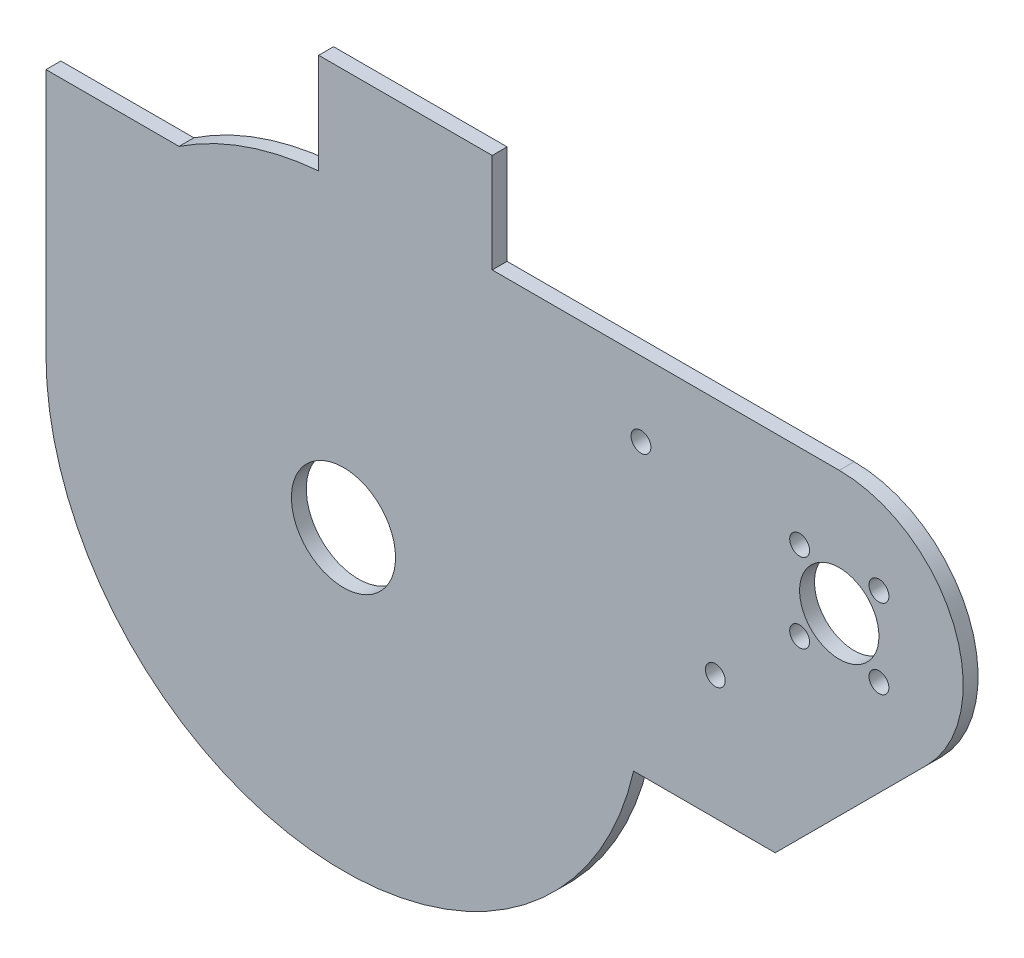
from build123d import *

# Parameters (mm, degrees)
SKETCH1_R           = 10.5
SKETCH1_R_2         = 8
BOSS_EXTRUDE1_DEPTH = 3
CUT_EXTRUDE1_REACH  = 140.687
SKETCH2_R           = 2
BOSS_EXTRUDE2_DEPTH = 3
SKETCH4_W           = 2
SKETCH4_H           = 6.5
SKETCH4_W_2         = 6.5
SKETCH4_H_2         = 2
BOSS_EXTRUDE3_DEPTH = 1
SKETCH5_R           = 2
CUT_EXTRUDE2_DEPTH  = 10


with BuildPart() as part:
    # Sketch1 → Boss-Extrude1 (new body)
    # profile 1 of 2: a face of its own
    with BuildSketch(Plane.XY):
        with BuildLine():
            ThreePointArc((-60, 0), (-52.867640737, 28.372743309), (-33.166247904, 50))
            Line((-33.166247904, 50), (-60, 50))
            Line((-60, 50), (-60, 0))
        make_face()
    # profile 2 of 2: a face of its own
    with BuildSketch(Plane.XY):
        with BuildLine():
            ThreePointArc((0, 60), (-17.320508076, 57.445626465), (-33.166247904, 50))
            ThreePointArc((-33.166247904, 50), (-52.867640737, 28.372743309), (-60, 0))
            ThreePointArc((-60, 0), (-6.678621673, -59.627141576), (58.513200418, -13.274237334))
            Line((58.513200418, -13.274237334), (87.081101726, -13.274237334))
            Line((87.081101726, -13.274237334), (117.67766953, 17.32233047))
            ThreePointArc((117.67766953, 17.32233047), (123.096988313, 44.567085809), (100, 60))
            Line((100, 60), (0, 60))
        make_face()
        Circle(SKETCH1_R, mode=Mode.SUBTRACT)
        with Locations((100, 35)):
            Circle(SKETCH1_R_2, mode=Mode.SUBTRACT)
    extrude(amount=BOSS_EXTRUDE1_DEPTH)

    # Sketch2 → Cut-Extrude1 (cut, up to next)
    with BuildSketch(Plane.XY.offset(3), mode=Mode.PRIVATE) as cut_extrude1_sk1:
        with Locations((60, 45)):
            Circle(SKETCH2_R)
    cut_extrude1_tool1 = extrude(cut_extrude1_sk1.sketch, amount=-CUT_EXTRUDE1_REACH, mode=Mode.PRIVATE) & part.part
    # Sketch2 → Cut-Extrude1 (cut, up to next)
    with BuildSketch(Plane.XY.offset(3), mode=Mode.PRIVATE) as cut_extrude1_sk2:
        with Locations((75, 11.725762666)):
            Circle(SKETCH2_R)
    cut_extrude1_tool2 = extrude(cut_extrude1_sk2.sketch, amount=-CUT_EXTRUDE1_REACH, mode=Mode.PRIVATE) & part.part
    add(cut_extrude1_tool1.solids().sort_by_distance((60, 45, 3))[0], mode=Mode.SUBTRACT)
    add(cut_extrude1_tool2.solids().sort_by_distance((75, 11.725763, 3))[0], mode=Mode.SUBTRACT)

    # Sketch3 → Boss-Extrude2 (add)
    with BuildSketch(Plane(origin=(0, 0, 0), x_dir=(-1, 0, 0), z_dir=(0, 0, -1))):
        with BuildLine():
            Line((-30, 80), (-30, 60))
            Line((-30, 60), (0, 60))
            ThreePointArc((0, 60), (2.502176759, 59.947803225), (5, 59.791303716))
            Line((5, 59.791303716), (5, 80))
            Line((5, 80), (-30, 80))
        make_face()
    extrude(amount=-BOSS_EXTRUDE2_DEPTH)

    # Sketch4 → Boss-Extrude3 (add)
    with BuildSketch(Plane(origin=(0, 0, 0), x_dir=(-1, 0, 0), z_dir=(0, 0, -1))):
        with Locations((-12.5, 68.846087829)):
            Rectangle(SKETCH4_W, SKETCH4_H)
        with Locations((-16.75, 64.596087829)):
            Rectangle(SKETCH4_W_2, SKETCH4_H_2)
        with Locations((-12.5, 64.596087829)):
            Rectangle(SKETCH4_W, SKETCH4_H_2)
        with Locations((-8.25, 64.596087829)):
            Rectangle(SKETCH4_W_2, SKETCH4_H_2)
        with Locations((-12.5, 60.346087829)):
            Rectangle(SKETCH4_W, SKETCH4_H)
    extrude(amount=BOSS_EXTRUDE3_DEPTH)

    # Sketch5 → Cut-Extrude2 (cut)
    with BuildSketch(Plane.XY.offset(3)):
        with Locations((92, 43)):
            Circle(SKETCH5_R)
        with Locations((108, 43)):
            Circle(SKETCH5_R)
        with Locations((108, 27)):
            Circle(SKETCH5_R)
        with Locations((92, 27)):
            Circle(SKETCH5_R)
    extrude(amount=-CUT_EXTRUDE2_DEPTH, mode=Mode.SUBTRACT)


solid = part.part
